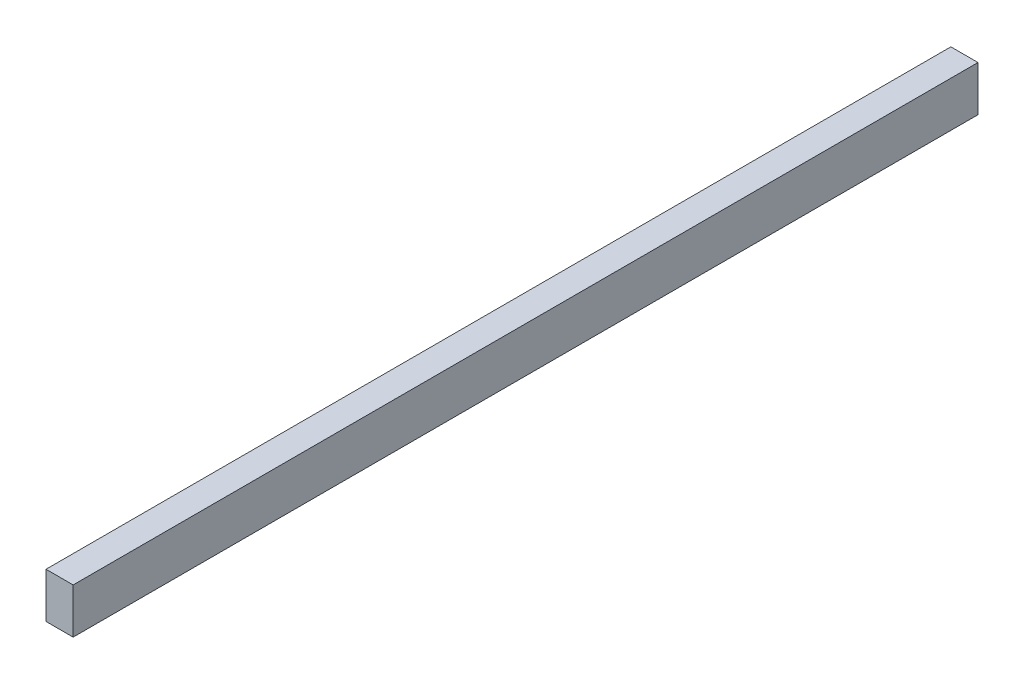
from build123d import *

# Parameters (mm, degrees)
SZKIC1_W                    = 12
SZKIC1_H                    = 20
DODANIE_WYCI_GNI_CIE1_DEPTH = 400


with BuildPart() as part:
    # Szkic1 → Dodanie-wyciągnięcie1 (new body)
    with BuildSketch(Plane.XY):
        Rectangle(SZKIC1_W, SZKIC1_H)
    extrude(amount=DODANIE_WYCI_GNI_CIE1_DEPTH)


solid = part.part
